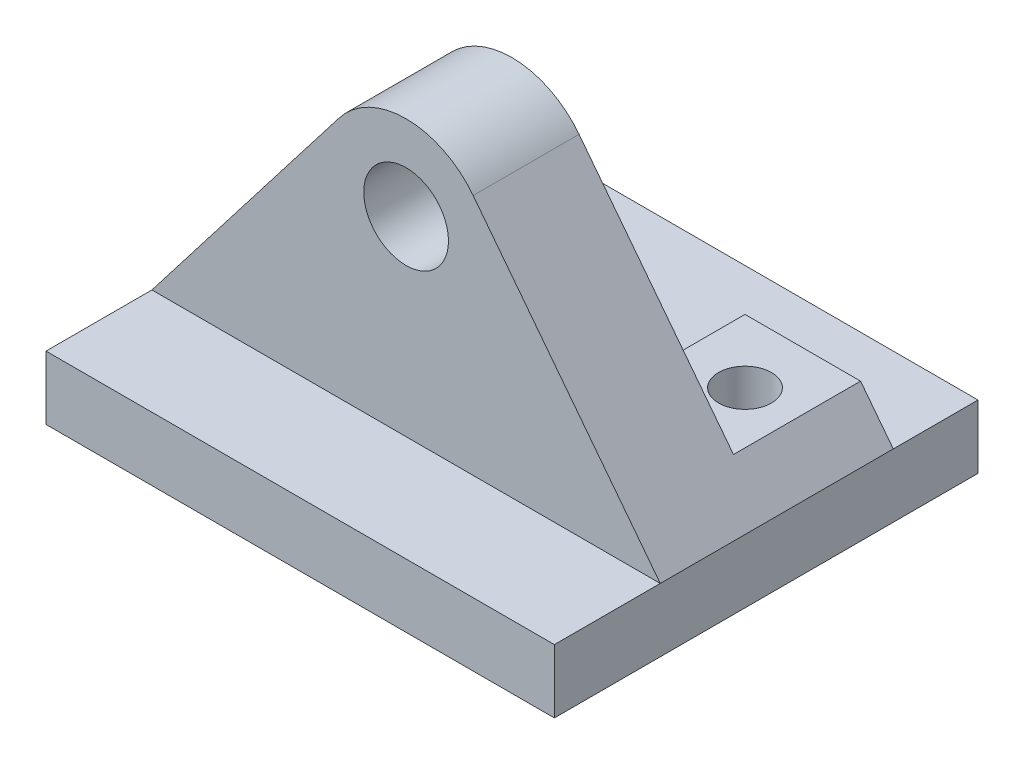
from build123d import *

# Parameters (mm, degrees)
SKETCH1_R           = 2
BOSS_EXTRUDE1_DEPTH = 15
SKETCH2_W           = 10
SKETCH2_H           = 23.787832066
CUT_EXTRUDE1_DEPTH  = 33.511536414
SKETCH5_W           = 7
SKETCH5_H           = 6
BOSS_EXTRUDE3_DEPTH = 2
SKETCH3_R           = 1.25
CUT_EXTRUDE2_DEPTH  = 33.511536414
SKETCH4_W           = 24
SKETCH4_H           = 3
BOSS_EXTRUDE2_DEPTH = 5
CUT_EXTRUDE3_DEPTH  = 31.528675045


with BuildPart() as part:
    # Sketch1 → Boss-Extrude1 (new body)
    with BuildSketch(Plane.XY):
        with BuildLine():
            Line((0, 0), (24, 0))
            Line((24, 0), (24, 3))
            Line((24, 3), (15.166426501, 14.444124223))
            ThreePointArc((15.166426501, 14.444124223), (12, 16), (8.833573499, 14.444124223))
            Line((8.833573499, 14.444124223), (0, 3))
            Line((0, 3), (0, 0))
        make_face()
        with Locations((12, 12)):
            Circle(SKETCH1_R, mode=Mode.SUBTRACT)
    extrude(amount=BOSS_EXTRUDE1_DEPTH)

    # Sketch2 → Cut-Extrude1 (cut, through all)
    with BuildSketch(Plane(origin=(24, 0, 0), x_dir=(0, 0, -1), z_dir=(1, 0, 0))):
        with Locations((-5, 14.893916033)):
            Rectangle(SKETCH2_W, SKETCH2_H)
    extrude(amount=-CUT_EXTRUDE1_DEPTH, mode=Mode.SUBTRACT)

    # Sketch5 → Boss-Extrude3 (add)
    with BuildSketch(Plane(origin=(0, 3, 0), x_dir=(-1, 0, 0), z_dir=(0, 1, 0))):
        with Locations((-20.5, 7)):
            Rectangle(SKETCH5_W, SKETCH5_H)
        with Locations((-3.5, 7)):
            Rectangle(SKETCH5_W, SKETCH5_H)
    extrude(amount=BOSS_EXTRUDE3_DEPTH)

    # Sketch3 → Cut-Extrude2 (cut, through all)
    with BuildSketch(Plane.XZ):
        with Locations((4, 7)):
            Circle(SKETCH3_R)
        with Locations((20, 7)):
            Circle(SKETCH3_R)
    extrude(amount=-CUT_EXTRUDE2_DEPTH, mode=Mode.SUBTRACT)

    # Sketch4 → Boss-Extrude2 (add)
    with BuildSketch(Plane(origin=(0, 14, 15), x_dir=(1, 0, 0), z_dir=(0, 0, -1))):
        with Locations((12, 12.5)):
            Rectangle(SKETCH4_W, SKETCH4_H)
    extrude(amount=-BOSS_EXTRUDE2_DEPTH)

    # Sketch6 → Cut-Extrude3 (cut, through all)
    with BuildSketch(Plane.XY.offset(10)):
        Polygon((0, 5), (0, 3), (1.543774487, 5), align=None)
        Polygon((24, 5), (22.456225513, 5), (24, 3), align=None)
    extrude(amount=-CUT_EXTRUDE3_DEPTH, mode=Mode.SUBTRACT)


solid = part.part
